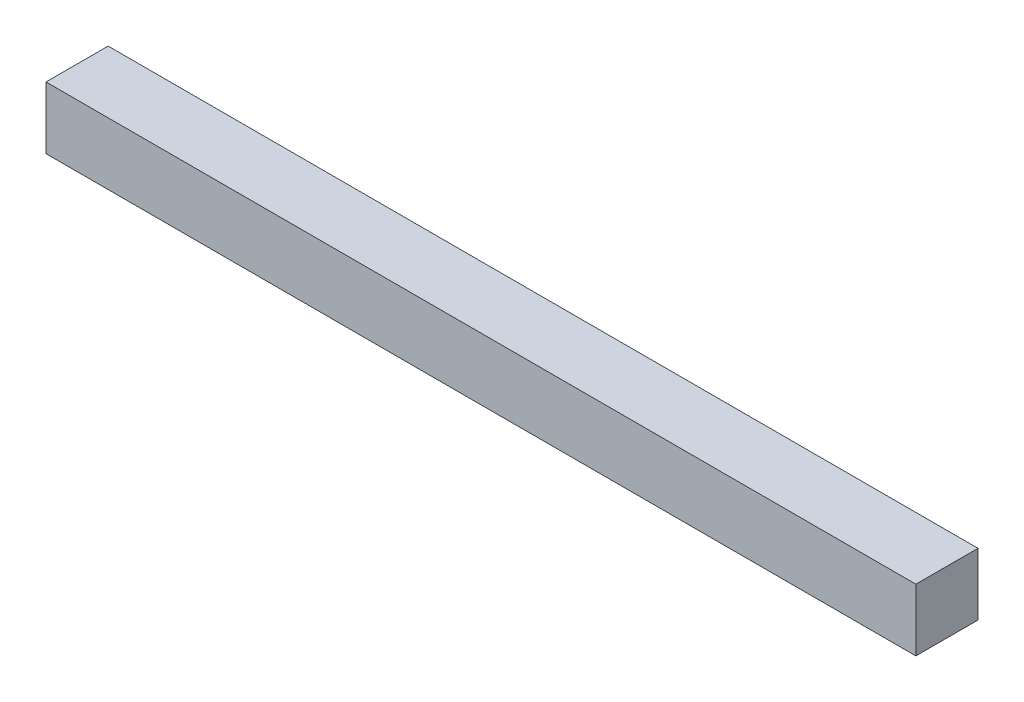
from build123d import *

# Parameters (mm, degrees)
BELT_DRIVE_AXLE_W   = 88.9
BELT_DRIVE_AXLE_H   = 6.35
BOSS_EXTRUDE1_DEPTH = 6.35


with BuildPart() as part:
    # Belt Drive Axle → Boss-Extrude1 (new body)
    with BuildSketch(Plane(origin=(0, 0, 0), x_dir=(1, 0, 0), z_dir=(0, 1, 0))):
        Rectangle(BELT_DRIVE_AXLE_W, BELT_DRIVE_AXLE_H)
    extrude(amount=BOSS_EXTRUDE1_DEPTH)


solid = part.part
